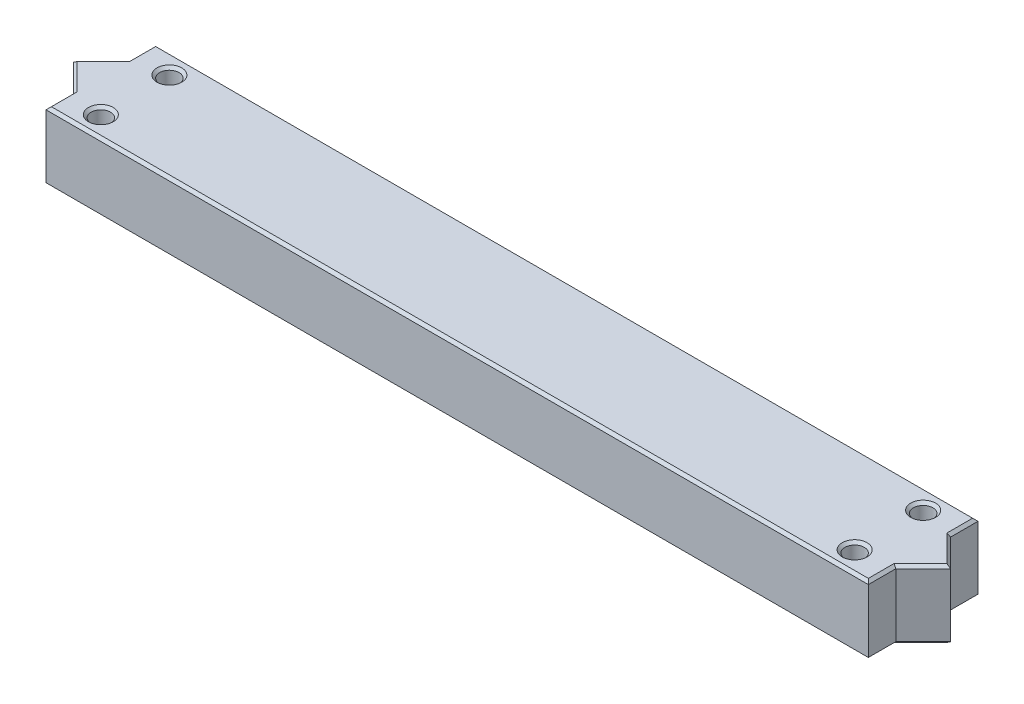
from build123d import *

# Parameters (mm, degrees)
SKETCH1_R           = 1.8
BOSS_EXTRUDE1_DEPTH = 12.7
CHAMFER1_SIZE       = 0.5


with BuildPart() as part:
    # Sketch1 → Boss-Extrude1 (new body)
    with BuildSketch(Plane(origin=(0, 0, 0), x_dir=(1, 0, 0), z_dir=(0, 1, 0))):
        Polygon((-76.2, 5.08), (-81.28, 0), (-76.2, -5.08), (-76.2, -10.16), (76.2, -10.16), (76.2, -5.08), (81.28, 0), (76.2, 5.08), (76.2, 10.16), (-76.2, 10.16), align=None)
        with Locations(Location((-69.85, 6.35, 0), (0, 0, 270))):
            Circle(SKETCH1_R, mode=Mode.SUBTRACT)
        with Locations(Location((-69.85, -6.35, 0), (0, 0, 90))):
            Circle(SKETCH1_R, mode=Mode.SUBTRACT)
        with Locations(Location((69.85, -6.35, 0), (0, 0, 270))):
            Circle(SKETCH1_R, mode=Mode.SUBTRACT)
        with Locations(Location((69.85, 6.35, 0), (0, 0, 90))):
            Circle(SKETCH1_R, mode=Mode.SUBTRACT)
    extrude(amount=BOSS_EXTRUDE1_DEPTH)

    # Chamfer1
    chamfer1_edges = [part.edges().sort_by_distance(p)[0] for p in [
        (0, 0, 10.16),
        (-76.2, 0, 7.62),
        (-78.74, 0, 2.54),
        (-78.74, 0, -2.54),
        (-76.2, 0, -7.62),
        (0, 0, -10.16),
        (76.2, 0, -7.62),
        (78.74, 12.7, -2.54),
        (78.74, 0, -2.54),
        (78.74, 0, 2.54),
        (76.2, 0, 7.62),
        (76.2, 12.7, -7.62),
        (0, 12.7, -10.16),
        (-76.2, 12.7, -7.62),
        (-69.85, 0, -8.15),
        (-69.85, 12.7, -8.15),
        (-78.74, 12.7, -2.54),
        (-69.85, 0, 8.15),
        (-69.85, 12.7, 8.15),
        (-78.74, 12.7, 2.54),
        (69.85, 0, 4.55),
        (69.85, 12.7, 4.55),
        (-76.2, 12.7, 7.62),
        (69.85, 0, -4.55),
        (69.85, 12.7, -4.55),
        (0, 12.7, 10.16),
        (76.2, 12.7, 7.62),
        (78.74, 12.7, 2.54),
    ]]
    chamfer(chamfer1_edges, length=CHAMFER1_SIZE)


solid = part.part
